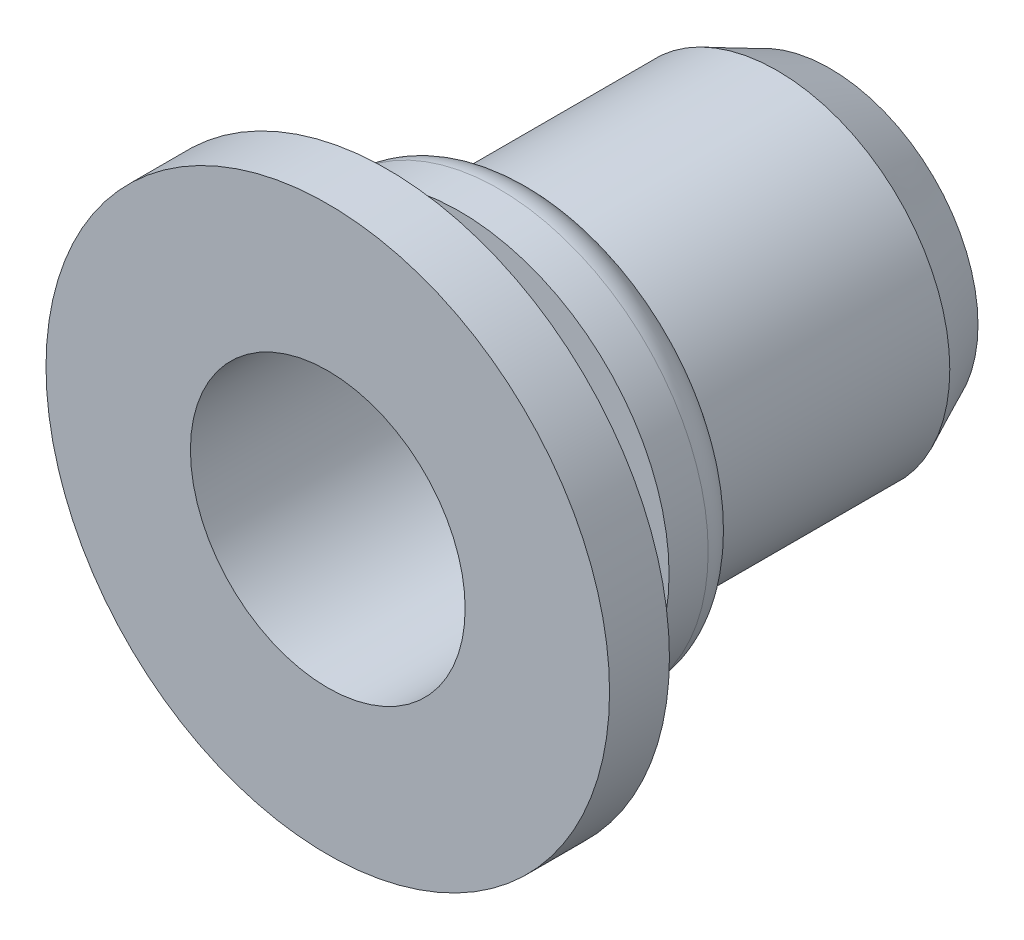
from build123d import *


with BuildPart() as part:
    # Sketch1 → Revolve1 (revolve)
    with BuildSketch(Plane(origin=(0, 0, 0), x_dir=(0, 0, -1), z_dir=(1, 0, 0)), mode=Mode.PRIVATE) as revolve1_sk:
        with BuildLine():
            Line((-0.85, 1.95), (2.03, 1.95))
            Line((2.03, 1.95), (2.03, 1.5))
            Line((2.03, 1.5), (2.186173248, 1.2295))
            Line((2.186173248, 1.2295), (6.123826752, 1.2295))
            Line((6.123826752, 1.2295), (6.28, 1.5))
            Line((6.28, 1.5), (6.28, 2.100269256))
            Line((6.28, 2.100269256), (5.53, 2.45))
            Line((5.53, 2.45), (2.1, 2.45))
            ThreePointArc((2.1, 2.45), (1.94623106, 2.82123106), (1.575, 2.975))
            Line((1.575, 2.975), (1.02, 2.975))
            Line((1.02, 2.975), (1.02, 2.45))
            Line((1.02, 2.45), (0, 2.45))
            Line((0, 2.45), (0, 4))
            Line((0, 4), (-0.85, 4))
            Line((-0.85, 4), (-0.85, 1.95))
        make_face()
    revolve(revolve1_sk.sketch.rotate(Axis((0, 0, 0), (0, 0, -1)), 90), axis=Axis((0, 0, 0), (0, 0, -1)))


solid = part.part
